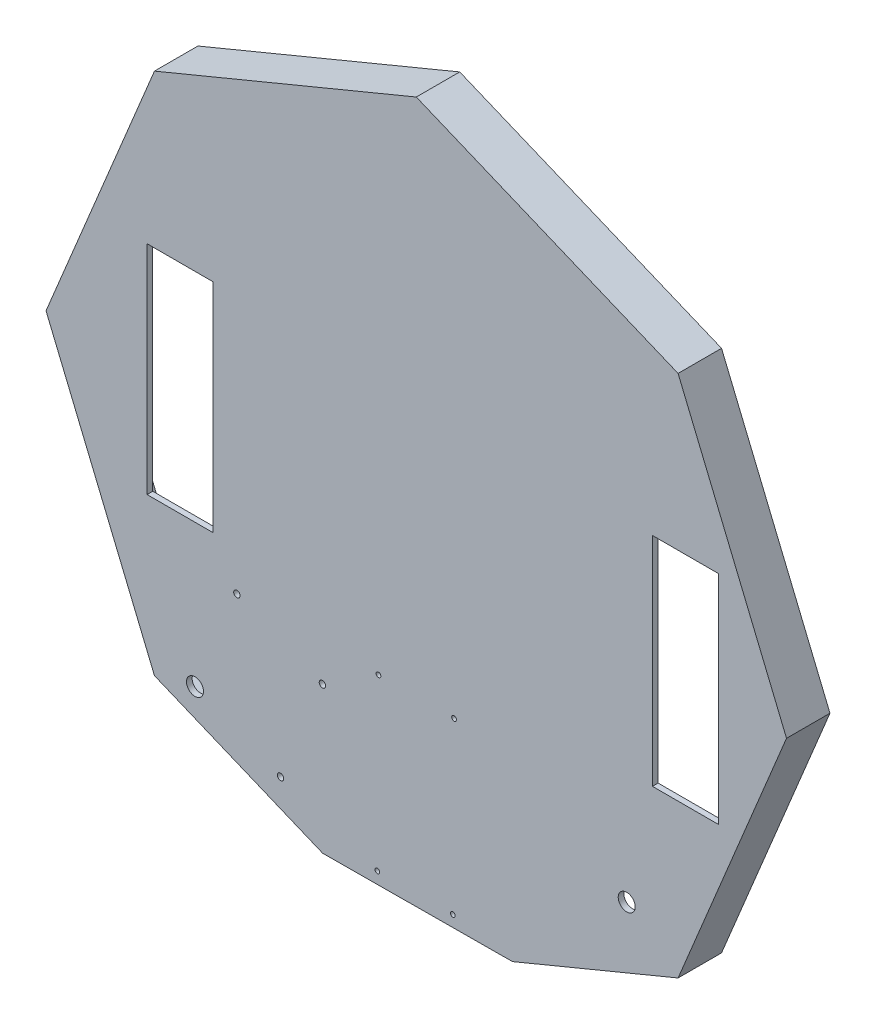
from build123d import *

# Parameters (mm, degrees)
BOSS_EXTRUDE1_DEPTH     = 3
SKETCH5_W               = 150
SKETCH5_H               = 20
BOSS_EXTRUDE2_DEPTH     = 3
MIRROR2_COPY_1_SKETCH_W = 150
MIRROR2_COPY_1_SKETCH_H = 20
MIRROR2_COPY_1_DEPTH    = 3
SKETCH6_W               = 23
SKETCH6_H               = 150
BOSS_EXTRUDE3_DEPTH     = 3
MIRROR4_COPY_1_SKETCH_W = 23
MIRROR4_COPY_1_SKETCH_H = 150
MIRROR4_COPY_1_DEPTH    = 3
MIRROR4_COPY_2_SKETCH_W = 23
MIRROR4_COPY_2_SKETCH_H = 150
MIRROR4_COPY_2_DEPTH    = 3
FILLET1_R               = 2
SKETCH4_W               = 35
SKETCH4_H               = 115
CUT_EXTRUDE1_DEPTH      = 10
TAP_DRILL_FOR_M3_TAP2_D = 2.5
TAP_DRILL_FOR_M3_TAP3_D = 2.5
M3_CLEARANCE_HOLE1_D    = 3.4
M8_CLEARANCE_HOLE1_D    = 9
CUT_EXTRUDE2_START      = -3
CUT_EXTRUDE2_DEPTH      = 23


with BuildPart() as part:
    # Sketch1 → Boss-Extrude1 (new body)
    with BuildSketch(Plane.XY):
        Polygon((0, 195.984444731), (-138.581929877, 138.581929877), (-195.984444731, 0), (-138.581929877, -138.581929877), (0, -195.984444731), (138.581929877, -138.581929877), (195.984444731, 0), (138.581929877, 138.581929877), align=None)
    boss_extrude1 = extrude(amount=BOSS_EXTRUDE1_DEPTH)

    # Sketch5 → Boss-Extrude2 (add)
    with BuildSketch(Plane(origin=(-69.290964938, -167.283187304, 0), x_dir=(0.9238795325112867, -0.38268343236509006, 0), z_dir=(-0.38268343236509, -0.9238795325112866, 0))):
        with Locations((0, -10)):
            Rectangle(SKETCH5_W, SKETCH5_H)
    boss_extrude2 = extrude(amount=-BOSS_EXTRUDE2_DEPTH)

    # Mirror1: Boss-Extrude2 across plane
    add(boss_extrude2.mirror(Plane.ZX))

    # Mirror2: Boss-Extrude2 across plane
    add(boss_extrude2.mirror(Plane(origin=(0, 0, 0), x_dir=(0, 0, 1), z_dir=(1, 0, 0))))

    # Mirror2 copy 1 sketch → Mirror2 copy 1 (add)
    with BuildSketch(Plane(origin=(69.290964938, 167.283187304, 0), x_dir=(-0.9238795325112867, 0.38268343236509006, 0), z_dir=(0.38268343236509, 0.9238795325112866, 0))):
        with Locations((0, -10)):
            Rectangle(MIRROR2_COPY_1_SKETCH_W, MIRROR2_COPY_1_SKETCH_H)
    extrude(amount=-MIRROR2_COPY_1_DEPTH)

    # Sketch6 → Boss-Extrude3 (add)
    with BuildSketch(Plane(origin=(-167.283187304, -69.290964938, 0), x_dir=(0, 0, 1), z_dir=(-0.9238795325112867, -0.3826834323650899, 0))):
        with Locations((-8.5, 0)):
            Rectangle(SKETCH6_W, SKETCH6_H)
    boss_extrude3 = extrude(amount=-BOSS_EXTRUDE3_DEPTH)

    # Mirror3: Boss-Extrude3 across plane
    add(boss_extrude3.mirror(Plane.ZX))

    # Mirror4: Boss-Extrude1 across plane
    add(boss_extrude1.mirror(Plane(origin=(0, 0, 0), x_dir=(0, 0, 1), z_dir=(1, 0, 0))))

    # Mirror4 copy 1 sketch → Mirror4 copy 1 (add)
    with BuildSketch(Plane(origin=(167.283187304, 69.290964938, 0), x_dir=(0, 0, 1), z_dir=(0.9238795325112867, 0.3826834323650899, 0))):
        with Locations((-8.5, 0)):
            Rectangle(MIRROR4_COPY_1_SKETCH_W, MIRROR4_COPY_1_SKETCH_H)
    extrude(amount=-MIRROR4_COPY_1_DEPTH)

    # Mirror4 copy 2 sketch → Mirror4 copy 2 (add)
    with BuildSketch(Plane(origin=(167.283187304, -69.290964938, 0), x_dir=(0, 0, 1), z_dir=(0.9238795325112867, -0.3826834323650899, 0))):
        with Locations((-8.5, 0)):
            Rectangle(MIRROR4_COPY_2_SKETCH_W, MIRROR4_COPY_2_SKETCH_H)
    extrude(amount=-MIRROR4_COPY_2_DEPTH)

    # Fillet1
    fillet1_edges = [part.edges().sort_by_distance(p)[0] for p in [
        (-164.511548707, -68.142914641, 0),
        (-164.511548707, 68.142914641, 0),
        (164.511548707, 68.142914641, 0),
        (164.511548707, -68.142914641, 0),
        (-68.142914641, 164.511548707, 0),
        (68.142914641, 164.511548707, 0),
        (-68.142914641, -164.511548707, 0),
        (68.142914641, -164.511548707, 0),
    ]]
    fillet(fillet1_edges, radius=FILLET1_R)

    # Sketch4 → Cut-Extrude1 (cut)
    with BuildSketch(Plane(origin=(0, 0, 0), x_dir=(-1, 0, 0), z_dir=(0, 0, -1))):
        with Locations((-142.5, 0)):
            Rectangle(SKETCH4_W, SKETCH4_H)
        with Locations((125, 0)):
            Rectangle(SKETCH4_W, SKETCH4_H)
    extrude(amount=-CUT_EXTRUDE1_DEPTH, mode=Mode.SUBTRACT)

    # Tap Drill for M3 Tap2 (through all)
    with Locations(Plane(origin=(0, 0, 0), x_dir=(-1, 0, 0), z_dir=(0, 0, -1))):
        with Locations((-19.343368816, -169.062877249), (20.628515922, -169.078590597)):
            Hole(TAP_DRILL_FOR_M3_TAP2_D / 2)

    # Tap Drill for M3 Tap3 (through all)
    with Locations(Plane(origin=(0, 0, 0), x_dir=(-1, 0, 0), z_dir=(0, 0, -1))):
        with Locations((-20, -78.890298866), (20, -78.890298866)):
            Hole(TAP_DRILL_FOR_M3_TAP3_D / 2)

    # M3 Clearance Hole1 (through all)
    with Locations(Plane.XY.offset(3)):
        with Locations((-49.680592478, -98.01502722), (-71.876231555, -151.600040105), (-117.146328648, -132.848551919), (-94.950689571, -79.263539034)):
            Hole(M3_CLEARANCE_HOLE1_D / 2)

    # M8 Clearance Hole1 (through all)
    with Locations(Plane.XY.offset(3)):
        with Locations((111.402419859, -117.376896871), (-117.146328648, -132.848551919)):
            Hole(M8_CLEARANCE_HOLE1_D / 2)

    # Sketch21 → Cut-Extrude2 (cut)
    with BuildSketch(Plane(origin=(0, 0, 0), x_dir=(-1, 0, 0), z_dir=(0, 0, -1)).offset(CUT_EXTRUDE2_START)):
        Polygon((0, -195.984444731), (-50.931031111, -174.8881209), (49.535442442, -175.466192654), align=None)
    extrude(amount=CUT_EXTRUDE2_DEPTH, mode=Mode.SUBTRACT)


solid = part.part
